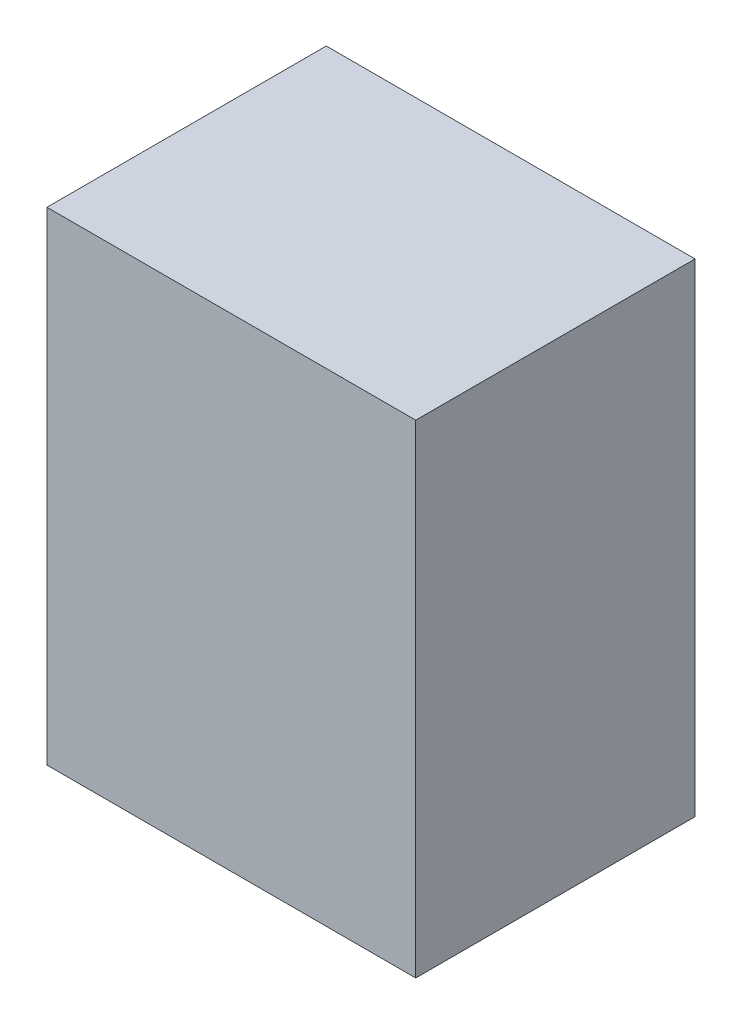
from build123d import *

# Parameters (mm, degrees)
SKETCH1_W                 = 9.57230149
SKETCH1_H                 = 12.54
BOSS_EXTRUDE1_DEPTH       = 7.25
SHELL1_T                  = -0.5
SHELL1_THICKNESS_2_FACE_W = 8.57230149
SHELL1_THICKNESS_2_FACE_H = 11.54
SHELL1_THICKNESS_2_DEPTH  = 0.3


with BuildPart() as part:
    # Sketch1 → Boss-Extrude1 (new body)
    with BuildSketch(Plane.XY):
        with Locations((74.250650745, -23.9)):
            Rectangle(SKETCH1_W, SKETCH1_H)
    extrude(amount=BOSS_EXTRUDE1_DEPTH)

    # Shell1
    shell1_openings = [part.faces().sort_by_distance(p)[0] for p in [
        (74.250650745, -23.9, 0),
    ]]
    offset(amount=SHELL1_T, openings=shell1_openings, kind=Kind.INTERSECTION)

    # Shell1 thickness 2 face (on inner face of the shell) → Shell1 thickness 2 (cut)
    with BuildSketch(Plane(origin=(74.250650745, -23.9, 6.75), x_dir=(1, 0, 0), z_dir=(0, 0, 1))):
        Rectangle(SHELL1_THICKNESS_2_FACE_W, SHELL1_THICKNESS_2_FACE_H)
    extrude(amount=SHELL1_THICKNESS_2_DEPTH, mode=Mode.SUBTRACT)


solid = part.part
